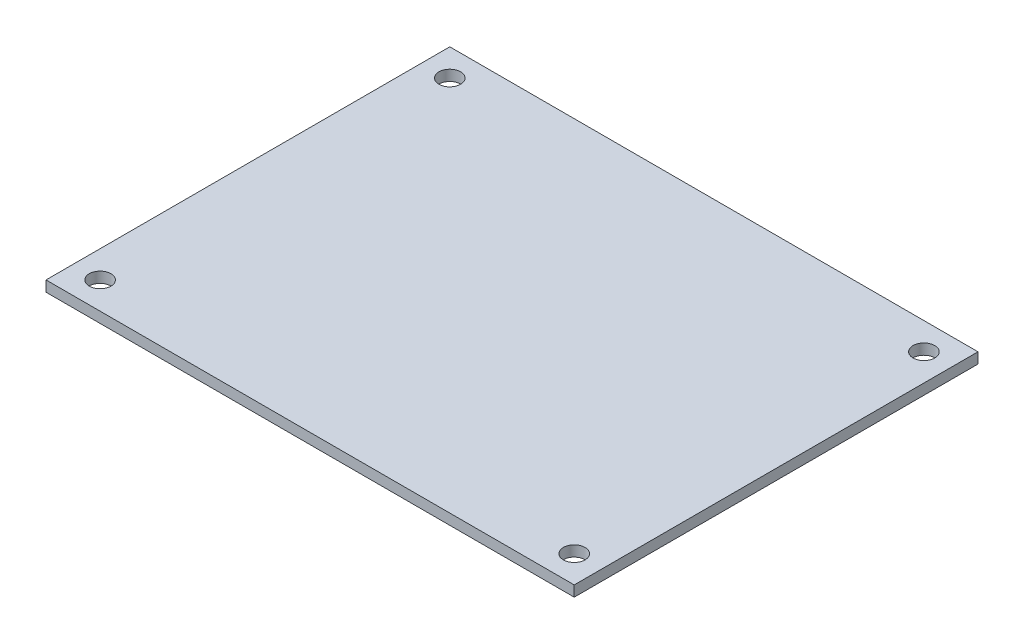
from build123d import *

# Parameters (mm, degrees)
SKETCH1_W           = 99.189999994
SKETCH1_H           = 75.819999998
SKETCH1_R           = 2.032
BOSS_EXTRUDE1_DEPTH = 2.000000064


with BuildPart() as part:
    # Sketch1 → Boss-Extrude1 (new body)
    with BuildSketch(Plane(origin=(0, 0, 0), x_dir=(1, 0, 0), z_dir=(0, 1, 0))):
        Rectangle(SKETCH1_W, SKETCH1_H)
        with Locations(Location((-44.514999997, -32.829999999, 0), (0, 0, 270))):
            Circle(SKETCH1_R, mode=Mode.SUBTRACT)
        with Locations(Location((44.514999997, -32.829999999, 0), (0, 0, 270))):
            Circle(SKETCH1_R, mode=Mode.SUBTRACT)
        with Locations(Location((44.514999997, 32.829999999, 0), (0, 0, 270))):
            Circle(SKETCH1_R, mode=Mode.SUBTRACT)
        with Locations(Location((-44.514999997, 32.829999999, 0), (0, 0, 270))):
            Circle(SKETCH1_R, mode=Mode.SUBTRACT)
    extrude(amount=BOSS_EXTRUDE1_DEPTH)


solid = part.part
